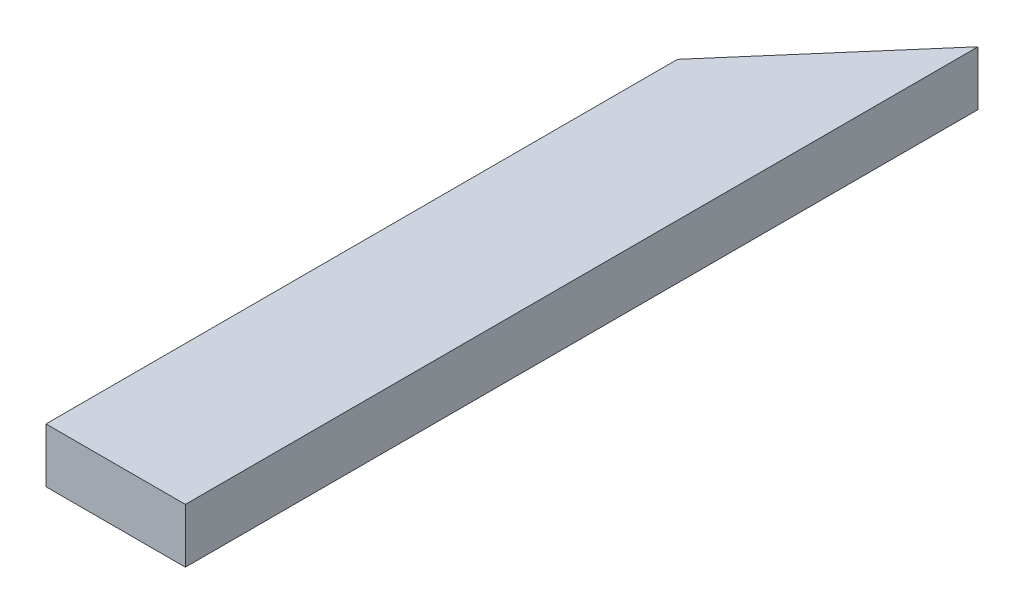
from build123d import *

# Parameters (mm, degrees)
BOSS_EXTRUDE1_DEPTH = 12.7


with BuildPart() as part:
    # Sketch1 → Boss-Extrude1 (new body)
    with BuildSketch(Plane(origin=(0, 0, 0), x_dir=(1, 0, 0), z_dir=(0, 1, 0))):
        Polygon((0, 0), (32.512, 0), (32.512, 184.912), (0, 147.32), align=None)
    extrude(amount=BOSS_EXTRUDE1_DEPTH)


solid = part.part
